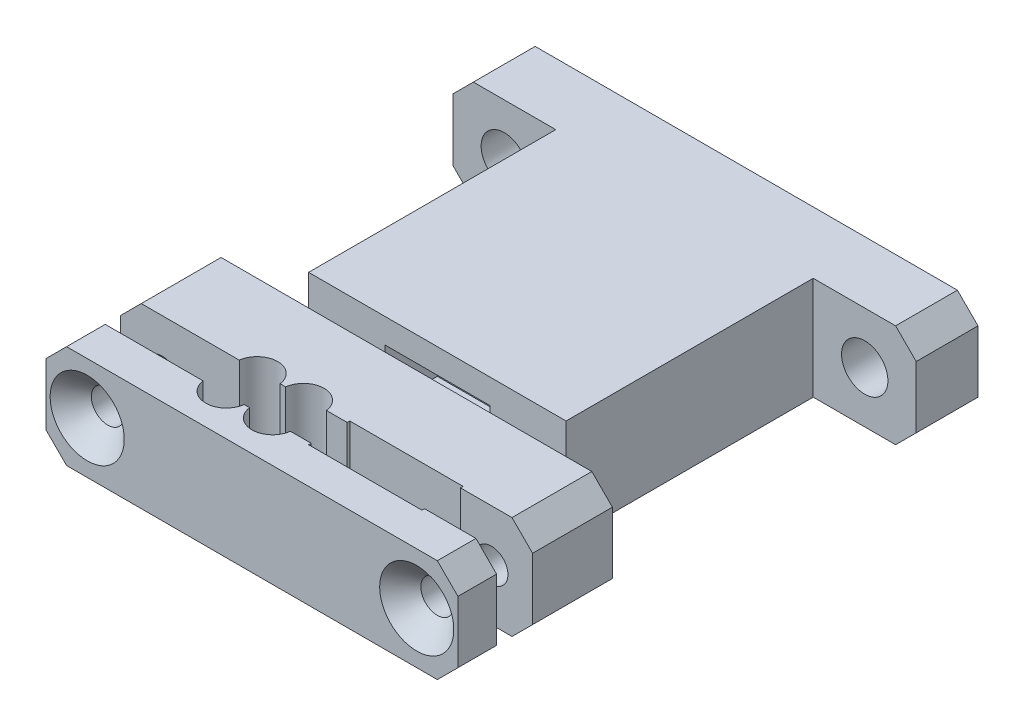
from build123d import *

# Parameters (mm, degrees)
BOSS_EXTRUDE2_DEPTH     = 5
SKETCH3_W               = 40
SKETCH3_H               = 12
SKETCH3_R               = 2
SKETCH3_W_2             = 11
SKETCH3_H_2             = 1
BOSS_EXTRUDE2_2_DEPTH   = 5
SKETCH4_R               = 2.25
CUT_EXTRUDE1_DEPTH      = 44.591857038
CUT_EXTRUDE2_DEPTH      = 5
CUT_EXTRUDE2_DEPTH_BACK = 12
SKETCH5_R               = 1.5
SKETCH6_W               = 10.2
SKETCH6_H               = 5.2
CUT_EXTRUDE3_DEPTH      = 5.1
SKETCH7_W               = 40
SKETCH7_H               = 0.5
CUT_EXTRUDE_THIN3_DEPTH = 50.550479312
SKETCH9_W               = 10.2
SKETCH9_H               = 5.2
CUT_EXTRUDE4_DEPTH      = 5.1
CUT_EXTRUDE5_START      = -12
SKETCH10_R              = 1.6
CUT_EXTRUDE5_DEPTH      = 12
CUT_EXTRUDE6_DEPTH      = 3
CHAMFER1_SIZE           = 2
CUT_EXTRUDE7_START      = -12
CUT_EXTRUDE7_DEPTH      = 12
CHAMFER2_SIZE           = 2


with BuildPart() as part:
    # Sketch3 → Boss-Extrude2 (new, symmetric)
    with BuildSketch(Plane(origin=(0, 0, 0), x_dir=(1, 0, 0), z_dir=(0, 1, 0))):
        Polygon((-12.5, -30), (12.5, -30), (12.5, -6), (22.5, -6), (22.5, 0), (-22.5, 0), (-22.5, -6), (-12.5, -6), align=None)
    extrude(amount=BOSS_EXTRUDE2_DEPTH, both=True)

    # Sketch4 → Cut-Extrude1 (cut, through all)
    with BuildSketch(Plane.XY.offset(6)):
        with Locations((17.5, 0)):
            Circle(SKETCH4_R)
        with Locations((-17.5, 0)):
            Circle(SKETCH4_R)
    extrude(amount=-CUT_EXTRUDE1_DEPTH, mode=Mode.SUBTRACT)


with BuildPart() as body_2:
    # Sketch3 → Boss-Extrude2 2 (new, symmetric)
    with BuildSketch(Plane(origin=(0, 0, 0), x_dir=(1, 0, 0), z_dir=(0, 1, 0))):
        with Locations((0, -37)):
            Rectangle(SKETCH3_W, SKETCH3_H)
        with Locations(Location((-6.5, -39, 0), (0, 0, 270))):
            Circle(SKETCH3_R, mode=Mode.SUBTRACT)
        with Locations(Location((-2, -39, 0), (0, 0, 270))):
            Circle(SKETCH3_R, mode=Mode.SUBTRACT)
        with Locations((7.5, -39)):
            Rectangle(SKETCH3_W_2, SKETCH3_H_2, mode=Mode.SUBTRACT)
    extrude(amount=BOSS_EXTRUDE2_2_DEPTH, both=True)


with BuildPart() as cut_extrude2_tool:
    # Sketch5 → Cut-Extrude2 (new, two sides: drawn at the far end of the back side and taken through both)
    with BuildSketch(Plane.XY.offset(30).offset(-CUT_EXTRUDE2_DEPTH_BACK)):
        with Locations(Location((-9, 0, 0), (0, 0, 180))):
            Circle(SKETCH5_R)
        with Locations(Location((9, 0, 0), (0, 0, 180))):
            Circle(SKETCH5_R)
    extrude(amount=CUT_EXTRUDE2_DEPTH + CUT_EXTRUDE2_DEPTH_BACK)


with BuildPart() as part_1:
    add(part.part)

    # Cut-Extrude2: cut by cut_extrude2_tool
    add(cut_extrude2_tool.part, mode=Mode.SUBTRACT)

    # Sketch6 → Cut-Extrude3 (cut)
    with BuildSketch(Plane.XY.offset(30)):
        Rectangle(SKETCH6_W, SKETCH6_H)
    extrude(amount=-CUT_EXTRUDE3_DEPTH, mode=Mode.SUBTRACT)

    # Chamfer2
    chamfer2_edges = [part_1.edges().sort_by_distance(p)[0] for p in [
        (-22.5, 5, 3),
        (22.5, -5, 3),
        (22.5, 5, 3),
        (-22.5, -5, 3),
    ]]
    chamfer(chamfer2_edges, length=CHAMFER2_SIZE)


with BuildPart() as body_2_1:
    add(body_2.part)

    # Cut-Extrude2: cut by cut_extrude2_tool
    add(cut_extrude2_tool.part, mode=Mode.SUBTRACT)

    # Sketch7 → Cut-Extrude-Thin3 (cut, through all)
    with BuildSketch(Plane(origin=(0, 5, 0), x_dir=(1, 0, 0), z_dir=(0, 1, 0))):
        with Locations((0, -39)):
            Rectangle(SKETCH7_W, SKETCH7_H)
    extrude(amount=-CUT_EXTRUDE_THIN3_DEPTH, mode=Mode.SUBTRACT)


with BuildPart() as cut_extrude_thin3_piece_1:
    # of the separate pieces the step leaves, piece 1, a body of its own (cut_extrude_thin3_pieces)
    add(body_2_1.part.solids().sort_by_distance((-20, -5, 31))[0])

    # Sketch9 → Cut-Extrude4 (cut)
    with BuildSketch(Plane(origin=(0, 0, 31), x_dir=(-1, 0, 0), z_dir=(0, 0, -1))):
        Rectangle(SKETCH9_W, SKETCH9_H)
    extrude(amount=-CUT_EXTRUDE4_DEPTH, mode=Mode.SUBTRACT)


with BuildPart() as cut_extrude_thin3_piece_2:
    # of the separate pieces the step leaves, piece 2, a body of its own (cut_extrude_thin3_pieces)
    add(body_2_1.part.solids().sort_by_distance((-20, -5, 43))[0])


with BuildPart() as cut_extrude_thin3_piece_1_1:
    # Body-Move/Copy1: moved
    add(cut_extrude_thin3_piece_1.part.moved(Location((0, 0, -1))))


with BuildPart() as cut_extrude_thin3_piece_2_1:
    # Body-Move/Copy1: moved
    add(cut_extrude_thin3_piece_2.part.moved(Location((0, 0, -1))))


with BuildPart() as cut_extrude5_tool:
    # Sketch10 → Cut-Extrude5 (new body)
    with BuildSketch(Plane.XY.offset(42).offset(CUT_EXTRUDE5_START)):
        with Locations((-16, 0)):
            Circle(SKETCH10_R)
        with Locations((16, 0)):
            Circle(SKETCH10_R)
    extrude(amount=CUT_EXTRUDE5_DEPTH)


with BuildPart() as cut_extrude_thin3_piece_1_2:
    add(cut_extrude_thin3_piece_1_1.part)

    # Cut-Extrude5: cut by cut_extrude5_tool
    add(cut_extrude5_tool.part, mode=Mode.SUBTRACT)

    # Sketch11 → Cut-Extrude6 (cut)
    with BuildSketch(Plane(origin=(0, 0, 30), x_dir=(-1, 0, 0), z_dir=(0, 0, -1))):
        Polygon((16, -3.290896534), (18.85, -1.645448267), (18.85, 1.645448267), (16, 3.290896534), (13.15, 1.645448267), (13.15, -1.645448267), align=None)
        Polygon((-16, -3.290896534), (-13.15, -1.645448267), (-13.15, 1.645448267), (-16, 3.290896534), (-18.85, 1.645448267), (-18.85, -1.645448267), align=None)
    extrude(amount=-CUT_EXTRUDE6_DEPTH, mode=Mode.SUBTRACT)


with BuildPart() as cut_extrude_thin3_piece_2_2:
    add(cut_extrude_thin3_piece_2_1.part)

    # Cut-Extrude5: cut by cut_extrude5_tool
    add(cut_extrude5_tool.part, mode=Mode.SUBTRACT)

    # Chamfer1
    chamfer1_edges = [cut_extrude_thin3_piece_2_2.edges().sort_by_distance(p)[0] for p in [
        (-17.6, 0, 42),
        (14.4, 0, 42),
    ]]
    chamfer(chamfer1_edges, length=CHAMFER1_SIZE)


with BuildPart() as cut_extrude7_tool:
    # Sketch12 → Cut-Extrude7 (new body)
    with BuildSketch(Plane.XY.offset(42).offset(CUT_EXTRUDE7_START)):
        Polygon((-20, 5), (-20, 3), (-18, 5), align=None)
        Polygon((-18, -5), (-20, -5), (-20, -3), align=None)
        Polygon((20, -5), (20, -3), (18, -5), align=None)
        Polygon((18, 5), (20, 5), (20, 3), align=None)
    extrude(amount=CUT_EXTRUDE7_DEPTH)


with BuildPart() as cut_extrude_thin3_piece_1_3:
    add(cut_extrude_thin3_piece_1_2.part)

    # Cut-Extrude7: cut by cut_extrude7_tool
    add(cut_extrude7_tool.part, mode=Mode.SUBTRACT)


with BuildPart() as cut_extrude_thin3_piece_2_3:
    add(cut_extrude_thin3_piece_2_2.part)

    # Cut-Extrude7: cut by cut_extrude7_tool
    add(cut_extrude7_tool.part, mode=Mode.SUBTRACT)


with BuildPart() as cut_extrude_thin3_piece_1_4:
    # Body-Move/Copy2: moved
    add(cut_extrude_thin3_piece_1_3.part.moved(Location((0, 0, 3))))


with BuildPart() as cut_extrude_thin3_piece_2_4:
    # Body-Move/Copy3: moved
    add(cut_extrude_thin3_piece_2_3.part.moved(Location((0, 0, 6))))


solid = Compound([part_1.part, cut_extrude_thin3_piece_1_4.part, cut_extrude_thin3_piece_2_4.part])
